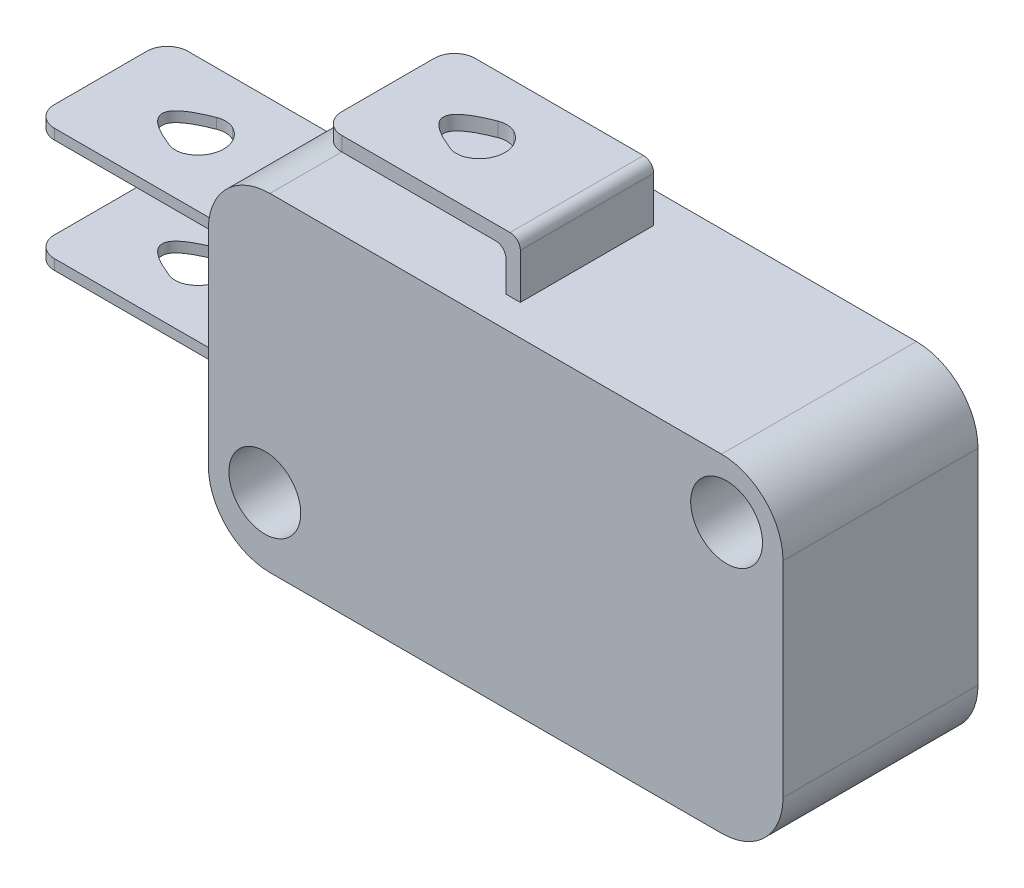
from build123d import *

# Parameters (mm, degrees)
BOSS_EXTRUDE1_DEPTH      = 3.25
BOSS_EXTRUDE1_DEPTH_BACK = 3.25
SKETCH1_W                = 10
SKETCH1_H                = 0.5
SKETCH1_W_2              = 28
SKETCH1_H_2              = 16
SKETCH1_R                = 1.75
BOSS_EXTRUDE2_DEPTH      = 1.5
BOSS_EXTRUDE2_DEPTH_BACK = 8
SKETCH2_W                = 28
SKETCH2_H                = 16
SKETCH2_R                = 1.75
CUT_EXTRUDE1_DEPTH       = 9.5
CUT_EXTRUDE2_DEPTH       = 1.5
FILLET1_R                = 1
FILLET2_R                = 1
FILLET3_R                = 3


with BuildPart() as part:
    # Sketch1 → Boss-Extrude1 (new, two sides: drawn at the far end of the back side and taken through both)
    # profile 1 of 4: a face of its own
    with BuildSketch(Plane.XY.offset(-BOSS_EXTRUDE1_DEPTH_BACK)):
        with Locations((-5, 6.25)):
            Rectangle(SKETCH1_W, SKETCH1_H)
    # profile 2 of 4: a face of its own
    with BuildSketch(Plane.XY.offset(-BOSS_EXTRUDE1_DEPTH_BACK)):
        with Locations((-5, 11.75)):
            Rectangle(SKETCH1_W, SKETCH1_H)
    # profile 3 of 4: a face of its own
    with BuildSketch(Plane.XY.offset(-BOSS_EXTRUDE1_DEPTH_BACK)):
        with Locations((14, 8)):
            Rectangle(SKETCH1_W_2, SKETCH1_H_2)
        with Locations((2.75, 3.25)):
            Circle(SKETCH1_R, mode=Mode.SUBTRACT)
        with Locations((25.25, 13.25)):
            Circle(SKETCH1_R, mode=Mode.SUBTRACT)
    # profile 4 of 4: a face of its own
    with BuildSketch(Plane.XY.offset(-BOSS_EXTRUDE1_DEPTH_BACK)):
        with BuildLine():
            Line((13, 16), (13.7, 16))
            Line((13.7, 16), (13.7, 18.2))
            ThreePointArc((13.7, 18.2), (13.553553391, 18.553553391), (13.2, 18.7))
            Line((13.2, 18.7), (4, 18.7))
            Line((4, 18.7), (4, 18))
            Line((4, 18), (12.5, 18))
            ThreePointArc((12.5, 18), (12.853553391, 17.853553391), (13, 17.5))
            Line((13, 17.5), (13, 16))
        make_face()
    extrude(amount=BOSS_EXTRUDE1_DEPTH + BOSS_EXTRUDE1_DEPTH_BACK)

    # Sketch2 → Boss-Extrude2 (add, two sides: drawn at the far end of the back side and taken through both)
    with BuildSketch(Plane(origin=(0, 0, -3.25), x_dir=(-1, 0, 0), z_dir=(0, 0, -1)).offset(-BOSS_EXTRUDE2_DEPTH_BACK)):
        with Locations((-14, 8)):
            Rectangle(SKETCH2_W, SKETCH2_H)
        with Locations(Location((-25.25, 13.25, 0), (0, 0, 180))):
            Circle(SKETCH2_R, mode=Mode.SUBTRACT)
        with Locations(Location((-2.75, 3.25, 0), (0, 0, 180))):
            Circle(SKETCH2_R, mode=Mode.SUBTRACT)
    extrude(amount=BOSS_EXTRUDE2_DEPTH + BOSS_EXTRUDE2_DEPTH_BACK)

    # Sketch3 → Cut-Extrude1 (cut)
    with BuildSketch(Plane(origin=(0, 12, 0), x_dir=(1, 0, 0), z_dir=(0, 1, 0))):
        with BuildLine():
            ThreePointArc((-5.25, -1.25), (-4, 0), (-5.25, 1.25))
            add(Edge.make_bspline(
                [(-5.25, 1.25), (-8.75, 0), (-5.25, -1.25)],
                knots=[0.849927106, 0.849927106, 0.849927106, 1.849927106, 1.849927106, 1.849927106], degree=2))
        make_face()
    extrude(amount=-CUT_EXTRUDE1_DEPTH, mode=Mode.SUBTRACT)

    # Sketch4 → Cut-Extrude2 (cut)
    with BuildSketch(Plane(origin=(0, 18.7, 0), x_dir=(1, 0, 0), z_dir=(0, 1, 0))):
        with BuildLine():
            ThreePointArc((8.45, -1.25), (9.7, 0), (8.45, 1.25))
            add(Edge.make_bspline(
                [(8.45, 1.25), (4.95, 0), (8.45, -1.25)],
                knots=[0.849927106, 0.849927106, 0.849927106, 1.849927106, 1.849927106, 1.849927106], degree=2))
        make_face()
    extrude(amount=-CUT_EXTRUDE2_DEPTH, mode=Mode.SUBTRACT)

    # Fillet1
    fillet1_edges = [part.edges().sort_by_distance(p)[0] for p in [
        (-5.25, 6.25, 1.25),
        (-5.25, 6.25, -1.25),
        (-5.25, 11.75, 1.25),
        (-5.25, 11.75, -1.25),
        (8.45, 18.35, -1.25),
        (8.45, 18.35, 1.25),
    ]]
    fillet(fillet1_edges, radius=FILLET1_R)

    # Fillet2
    fillet2_edges = [part.edges().sort_by_distance(p)[0] for p in [
        (-10, 6.25, -3.25),
        (4, 18.35, -3.25),
        (-10, 6.25, 3.25),
        (-10, 11.75, 3.25),
        (4, 18.35, 3.25),
        (-10, 11.75, -3.25),
    ]]
    fillet(fillet2_edges, radius=FILLET2_R)

    # Fillet3
    fillet3_edges = [part.edges().sort_by_distance(p)[0] for p in [
        (0, 16, 0),
        (28, 16, 0),
        (28, 0, 0),
        (0, 0, 0),
    ]]
    fillet(fillet3_edges, radius=FILLET3_R)


solid = part.part
